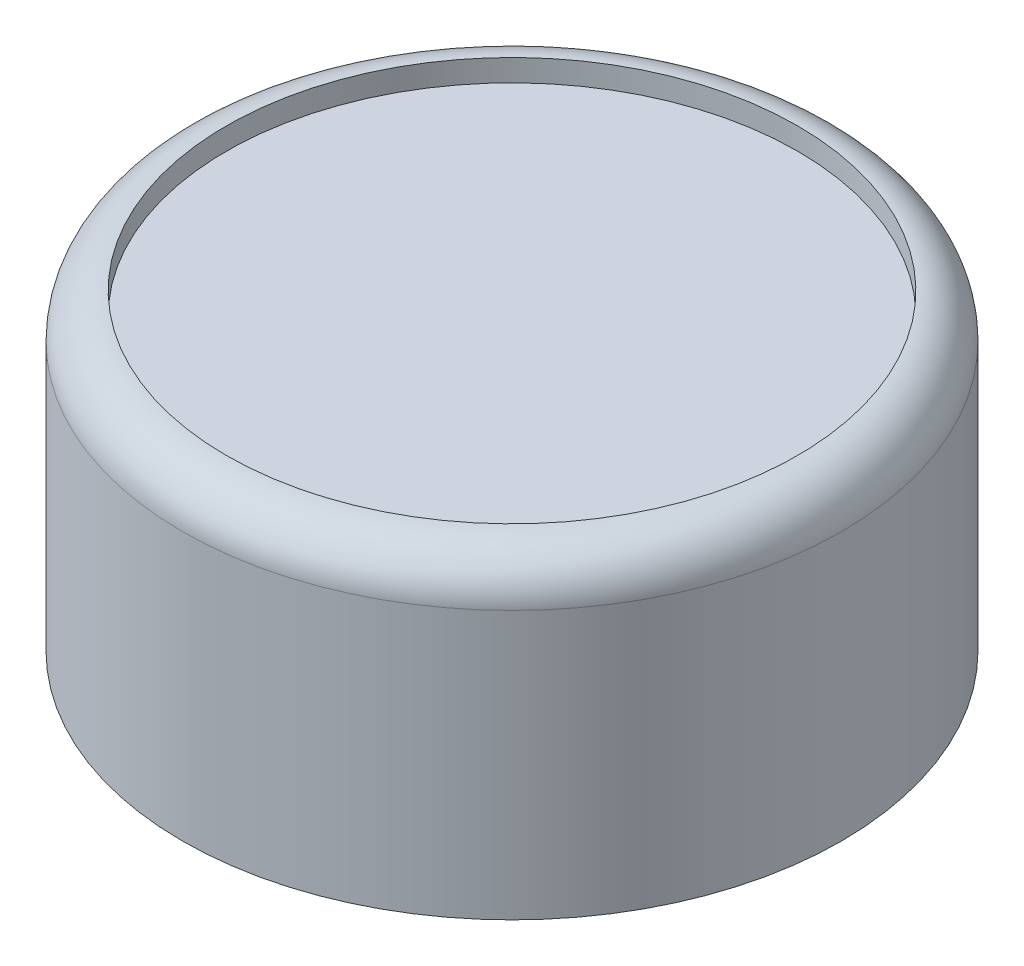
from build123d import *

# Parameters (mm, degrees)
SKETCH1_R           = 15
BOSS_EXTRUDE1_DEPTH = 14.2
SHELL1_T            = -2
EXTRUDE_THIN2_DEPTH = 7
RIB1_REACH          = 25.043
SKETCH3_WALLS_W     = 2
SKETCH3_WALLS_H     = 57.886874488
CIRPATTERN1_COUNT   = 4
FILLET1_R           = 2
SKETCH4_R           = 13
CUT_EXTRUDE1_DEPTH  = 1


with BuildPart() as part:
    # Sketch1 → Boss-Extrude1 (new body)
    with BuildSketch(Plane(origin=(0, 0, 0), x_dir=(1, 0, 0), z_dir=(0, 1, 0))):
        with Locations(Location((0, 0, 0), (0, 0, 270))):
            Circle(SKETCH1_R)
    extrude(amount=-BOSS_EXTRUDE1_DEPTH)

    # Shell1
    shell1_openings = [part.faces().sort_by_distance(p)[0] for p in [
        (0, -14.2, 0),
    ]]
    offset(amount=SHELL1_T, openings=shell1_openings, kind=Kind.INTERSECTION)

    # Sketch2 → Extrude-Thin2 (add)
    with BuildSketch(Plane.XZ.offset(2)):
        with BuildLine():
            Line((-4.098780306, -3.2), (4.098780306, -3.2))
            ThreePointArc((4.098780306, -3.2), (0, 5.2), (-4.098780306, -3.2))
        make_face()
        with BuildLine():
            Line((-2.966479395, -1.2), (2.966479395, -1.2))
            ThreePointArc((2.966479395, -1.2), (0, 3.2), (-2.966479395, -1.2))
        make_face(mode=Mode.SUBTRACT)
    extrude(amount=EXTRUDE_THIN2_DEPTH)

    # Sketch3 walls → Rib1 (add, up to next)
    with BuildSketch(Plane.XZ.offset(9), mode=Mode.PRIVATE) as rib1_sk1:
        with Locations((0, -8.1)):
            Rectangle(SKETCH3_WALLS_W, SKETCH3_WALLS_H)
    rib1_tool1 = extrude(rib1_sk1.sketch, amount=-RIB1_REACH, mode=Mode.PRIVATE) - part.part
    rib1 = rib1_tool1.solids().sort_by_distance((0, -9, -8.1))[0]
    add(rib1)

    # CirPattern1: Rib1 ×4 about axis
    cirpattern1_axis = Axis((0, 0, 0), (0, 1, 0))
    for i in range(1, CIRPATTERN1_COUNT):
        add(rib1.rotate(cirpattern1_axis, i * 360 / CIRPATTERN1_COUNT))

    # Fillet1
    fillet1_edges = [part.edges().sort_by_distance(p)[0] for p in [
        (0, 0, -15),
    ]]
    fillet(fillet1_edges, radius=FILLET1_R)

    # Sketch4 → Cut-Extrude1 (cut)
    with BuildSketch(Plane(origin=(0, 0, 0), x_dir=(1, 0, 0), z_dir=(0, 1, 0))):
        with Locations(Location((0, 0, 0), (0, 0, 270))):
            Circle(SKETCH4_R)
    extrude(amount=-CUT_EXTRUDE1_DEPTH, mode=Mode.SUBTRACT)


solid = part.part
